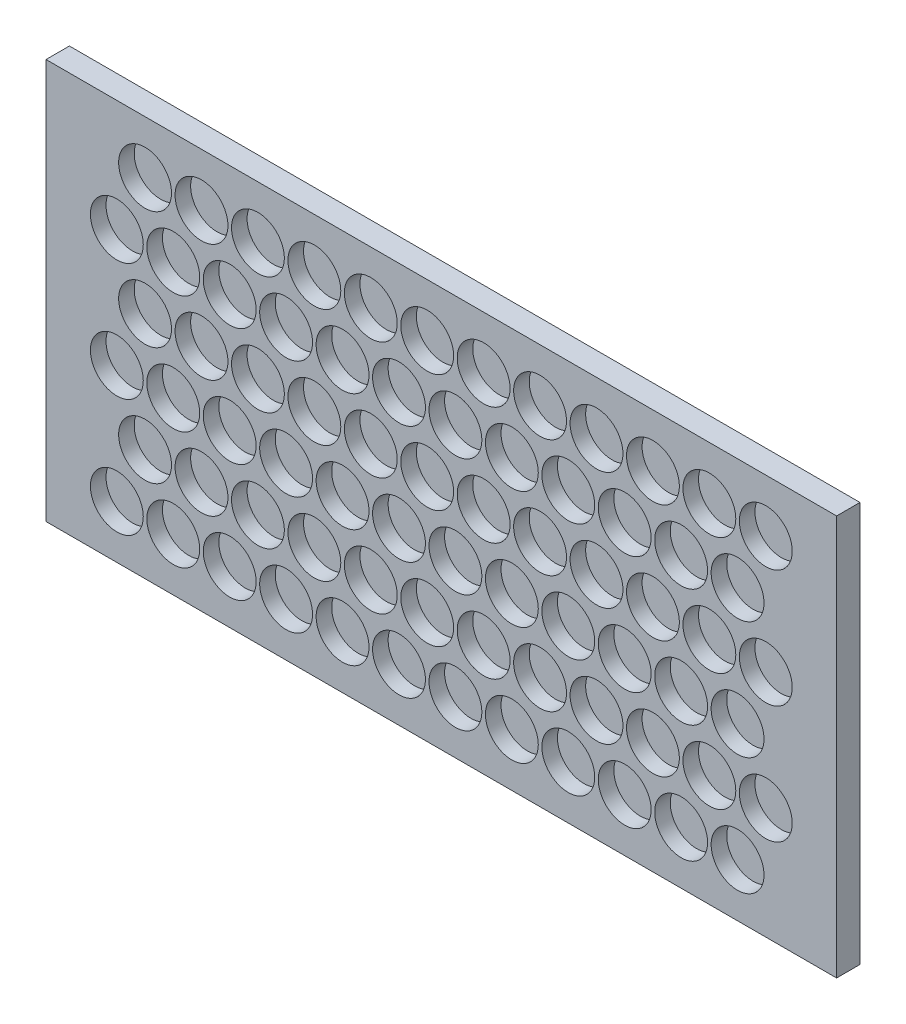
from build123d import *

# Parameters (mm, degrees)
SKETCH1_W           = 322.22857931
SKETCH1_H           = 163.1
BOSS_EXTRUDE1_DEPTH = 6.35
SKETCH2_R           = 10.775
CUT_EXTRUDE1_DEPTH  = 362.210727726
SKETCH4_W           = 322.22857931
SKETCH4_H           = 163.1
BOSS_EXTRUDE3_DEPTH = 3.175


with BuildPart() as part:
    # Sketch1 → Boss-Extrude1 (new body)
    with BuildSketch(Plane.XY):
        with Locations((161.114289655, 81.55)):
            Rectangle(SKETCH1_W, SKETCH1_H)
    extrude(amount=BOSS_EXTRUDE1_DEPTH)

    # Sketch2 → Cut-Extrude1 (cut, through all)
    with BuildSketch(Plane.XY.offset(6.35)):
        with Locations((28.8625, 21.55)):
            Circle(SKETCH2_R)
        with Locations((40.366079306, 45.544994544)):
            Circle(SKETCH2_R)
        with Locations((51.8625, 21.55)):
            Circle(SKETCH2_R)
        with Locations((74.8625, 21.55)):
            Circle(SKETCH2_R)
        with Locations((97.8625, 21.55)):
            Circle(SKETCH2_R)
        with Locations((120.8625, 21.55)):
            Circle(SKETCH2_R)
        with Locations((143.8625, 21.55)):
            Circle(SKETCH2_R)
        with Locations((166.8625, 21.55)):
            Circle(SKETCH2_R)
        with Locations((189.8625, 21.55)):
            Circle(SKETCH2_R)
        with Locations((212.8625, 21.55)):
            Circle(SKETCH2_R)
        with Locations((235.8625, 21.55)):
            Circle(SKETCH2_R)
        with Locations((258.8625, 21.55)):
            Circle(SKETCH2_R)
        with Locations((281.8625, 21.55)):
            Circle(SKETCH2_R)
        with Locations((293.366079306, 45.544994544)):
            Circle(SKETCH2_R)
        with Locations((293.366079306, 93.544994544)):
            Circle(SKETCH2_R)
        with Locations((293.366079306, 141.544994544)):
            Circle(SKETCH2_R)
        with Locations((28.8625, 117.55)):
            Circle(SKETCH2_R)
        with Locations((28.8625, 69.55)):
            Circle(SKETCH2_R)
        with Locations((63.366079306, 45.544994544)):
            Circle(SKETCH2_R)
        with Locations((86.366079306, 45.544994544)):
            Circle(SKETCH2_R)
        with Locations((109.366079306, 45.544994544)):
            Circle(SKETCH2_R)
        with Locations((132.366079306, 45.544994544)):
            Circle(SKETCH2_R)
        with Locations((155.366079306, 45.544994544)):
            Circle(SKETCH2_R)
        with Locations((178.366079306, 45.544994544)):
            Circle(SKETCH2_R)
        with Locations((201.366079306, 45.544994544)):
            Circle(SKETCH2_R)
        with Locations((224.366079306, 45.544994544)):
            Circle(SKETCH2_R)
        with Locations((247.366079306, 45.544994544)):
            Circle(SKETCH2_R)
        with Locations((270.366079306, 45.544994544)):
            Circle(SKETCH2_R)
        with Locations((51.8625, 69.55)):
            Circle(SKETCH2_R)
        with Locations((74.8625, 69.55)):
            Circle(SKETCH2_R)
        with Locations((97.8625, 69.55)):
            Circle(SKETCH2_R)
        with Locations((120.8625, 69.55)):
            Circle(SKETCH2_R)
        with Locations((143.8625, 69.55)):
            Circle(SKETCH2_R)
        with Locations((166.8625, 69.55)):
            Circle(SKETCH2_R)
        with Locations((189.8625, 69.55)):
            Circle(SKETCH2_R)
        with Locations((212.8625, 69.55)):
            Circle(SKETCH2_R)
        with Locations((235.8625, 69.55)):
            Circle(SKETCH2_R)
        with Locations((258.8625, 69.55)):
            Circle(SKETCH2_R)
        with Locations((281.8625, 69.55)):
            Circle(SKETCH2_R)
        with Locations((51.8625, 117.55)):
            Circle(SKETCH2_R)
        with Locations((74.8625, 117.55)):
            Circle(SKETCH2_R)
        with Locations((97.8625, 117.55)):
            Circle(SKETCH2_R)
        with Locations((120.8625, 117.55)):
            Circle(SKETCH2_R)
        with Locations((143.8625, 117.55)):
            Circle(SKETCH2_R)
        with Locations((166.8625, 117.55)):
            Circle(SKETCH2_R)
        with Locations((189.8625, 117.55)):
            Circle(SKETCH2_R)
        with Locations((212.8625, 117.55)):
            Circle(SKETCH2_R)
        with Locations((235.8625, 117.55)):
            Circle(SKETCH2_R)
        with Locations((258.8625, 117.55)):
            Circle(SKETCH2_R)
        with Locations((281.8625, 117.55)):
            Circle(SKETCH2_R)
        with Locations((40.366079306, 93.544994544)):
            Circle(SKETCH2_R)
        with Locations((63.366079306, 93.544994544)):
            Circle(SKETCH2_R)
        with Locations((86.366079306, 93.544994544)):
            Circle(SKETCH2_R)
        with Locations((109.366079306, 93.544994544)):
            Circle(SKETCH2_R)
        with Locations((132.366079306, 93.544994544)):
            Circle(SKETCH2_R)
        with Locations((155.366079306, 93.544994544)):
            Circle(SKETCH2_R)
        with Locations((178.366079306, 93.544994544)):
            Circle(SKETCH2_R)
        with Locations((201.366079306, 93.544994544)):
            Circle(SKETCH2_R)
        with Locations((224.366079306, 93.544994544)):
            Circle(SKETCH2_R)
        with Locations((247.366079306, 93.544994544)):
            Circle(SKETCH2_R)
        with Locations((270.366079306, 93.544994544)):
            Circle(SKETCH2_R)
        with Locations((40.366079306, 141.544994544)):
            Circle(SKETCH2_R)
        with Locations((63.366079306, 141.544994544)):
            Circle(SKETCH2_R)
        with Locations((86.366079306, 141.544994544)):
            Circle(SKETCH2_R)
        with Locations((109.366079306, 141.544994544)):
            Circle(SKETCH2_R)
        with Locations((132.366079306, 141.544994544)):
            Circle(SKETCH2_R)
        with Locations((155.366079306, 141.544994544)):
            Circle(SKETCH2_R)
        with Locations((178.366079306, 141.544994544)):
            Circle(SKETCH2_R)
        with Locations((201.366079306, 141.544994544)):
            Circle(SKETCH2_R)
        with Locations((224.366079306, 141.544994544)):
            Circle(SKETCH2_R)
        with Locations((247.366079306, 141.544994544)):
            Circle(SKETCH2_R)
        with Locations((270.366079306, 141.544994544)):
            Circle(SKETCH2_R)
    extrude(amount=-CUT_EXTRUDE1_DEPTH, mode=Mode.SUBTRACT)

    # Sketch4 → Boss-Extrude3 (add)
    with BuildSketch(Plane(origin=(0, 0, 0), x_dir=(-1, 0, 0), z_dir=(0, 0, -1))):
        with Locations((-161.114289655, 81.55)):
            Rectangle(SKETCH4_W, SKETCH4_H)
    extrude(amount=BOSS_EXTRUDE3_DEPTH)


solid = part.part
